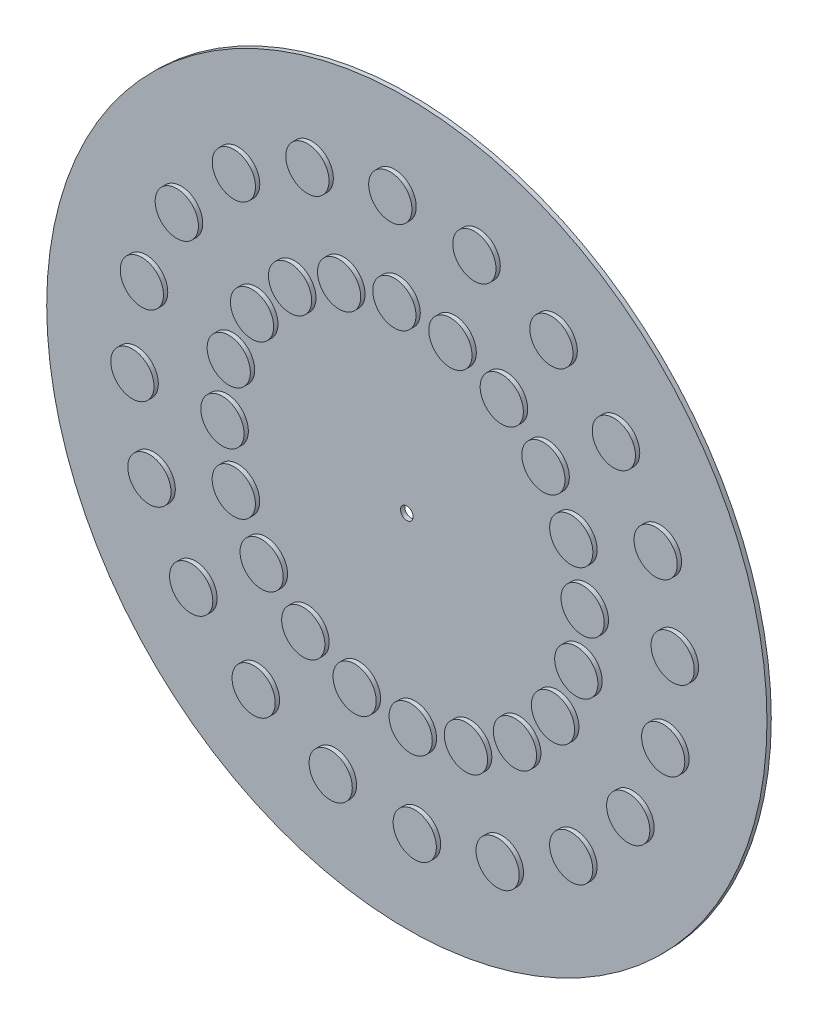
from build123d import *

# Parameters (mm, degrees)
SKETCH1_R           = 100
SKETCH1_R_2         = 1.75
BOSS_EXTRUDE1_DEPTH = 1.2
SKETCH2_R           = 6
BOSS_EXTRUDE2_DEPTH = 1.2


with BuildPart() as part:
    # Sketch1 → Boss-Extrude1 (new body)
    with BuildSketch(Plane.XY):
        Circle(SKETCH1_R)
        Circle(SKETCH1_R_2, mode=Mode.SUBTRACT)
    extrude(amount=BOSS_EXTRUDE1_DEPTH)

    # Sketch2 → Boss-Extrude2 (add)
    with BuildSketch(Plane.XY.offset(1.2)):
        with Locations((-3.396039654, 75)):
            Circle(SKETCH2_R)
        with Locations((19.946448935, 72.378672689)):
            Circle(SKETCH2_R)
        with Locations((41.336440128, 62.672416603)):
            Circle(SKETCH2_R)
        with Locations((58.680132553, 46.831347716)):
            Circle(SKETCH2_R)
        with Locations((70.279804755, 26.406100221)):
            Circle(SKETCH2_R)
        with Locations((75, 3.396039654)):
            Circle(SKETCH2_R)
        with Locations((72.378672689, -19.946448935)):
            Circle(SKETCH2_R)
        with Locations((62.672416603, -41.336440128)):
            Circle(SKETCH2_R)
        with Locations((46.831347716, -58.680132553)):
            Circle(SKETCH2_R)
        with Locations((26.406100221, -70.279804755)):
            Circle(SKETCH2_R)
        with Locations((3.396039654, -75)):
            Circle(SKETCH2_R)
        with Locations((-19.946448935, -72.378672689)):
            Circle(SKETCH2_R)
        with Locations((-41.336440128, -62.672416603)):
            Circle(SKETCH2_R)
        with Locations((-58.680132553, -46.831347716)):
            Circle(SKETCH2_R)
        with Locations((-70.279804755, -26.406100221)):
            Circle(SKETCH2_R)
        with Locations((-75, -3.396039654)):
            Circle(SKETCH2_R)
        with Locations((-72.378672689, 19.946448935)):
            Circle(SKETCH2_R)
        with Locations((-62.672416603, 41.336440128)):
            Circle(SKETCH2_R)
        with Locations((-46.831347716, 58.680132553)):
            Circle(SKETCH2_R)
        with Locations((-26.406100221, 70.279804755)):
            Circle(SKETCH2_R)
        with Locations((-2.264026436, 50)):
            Circle(SKETCH2_R)
        with Locations((13.297632623, 48.252448459)):
            Circle(SKETCH2_R)
        with Locations((27.557626752, 41.781611069)):
            Circle(SKETCH2_R)
        with Locations((39.120088369, 31.220898477)):
            Circle(SKETCH2_R)
        with Locations((46.85320317, 17.604066814)):
            Circle(SKETCH2_R)
        with Locations((50, 2.264026436)):
            Circle(SKETCH2_R)
        with Locations((48.252448459, -13.297632623)):
            Circle(SKETCH2_R)
        with Locations((41.781611069, -27.557626752)):
            Circle(SKETCH2_R)
        with Locations((31.220898477, -39.120088369)):
            Circle(SKETCH2_R)
        with Locations((17.604066814, -46.85320317)):
            Circle(SKETCH2_R)
        with Locations((2.264026436, -50)):
            Circle(SKETCH2_R)
        with Locations((-13.297632623, -48.252448459)):
            Circle(SKETCH2_R)
        with Locations((-27.557626752, -41.781611069)):
            Circle(SKETCH2_R)
        with Locations((-39.120088369, -31.220898477)):
            Circle(SKETCH2_R)
        with Locations((-46.85320317, -17.604066814)):
            Circle(SKETCH2_R)
        with Locations((-50, -2.264026436)):
            Circle(SKETCH2_R)
        with Locations((-48.252448459, 13.297632623)):
            Circle(SKETCH2_R)
        with Locations((-41.781611069, 27.557626752)):
            Circle(SKETCH2_R)
        with Locations((-31.220898477, 39.120088369)):
            Circle(SKETCH2_R)
        with Locations((-17.604066814, 46.85320317)):
            Circle(SKETCH2_R)
    extrude(amount=BOSS_EXTRUDE2_DEPTH)


solid = part.part
